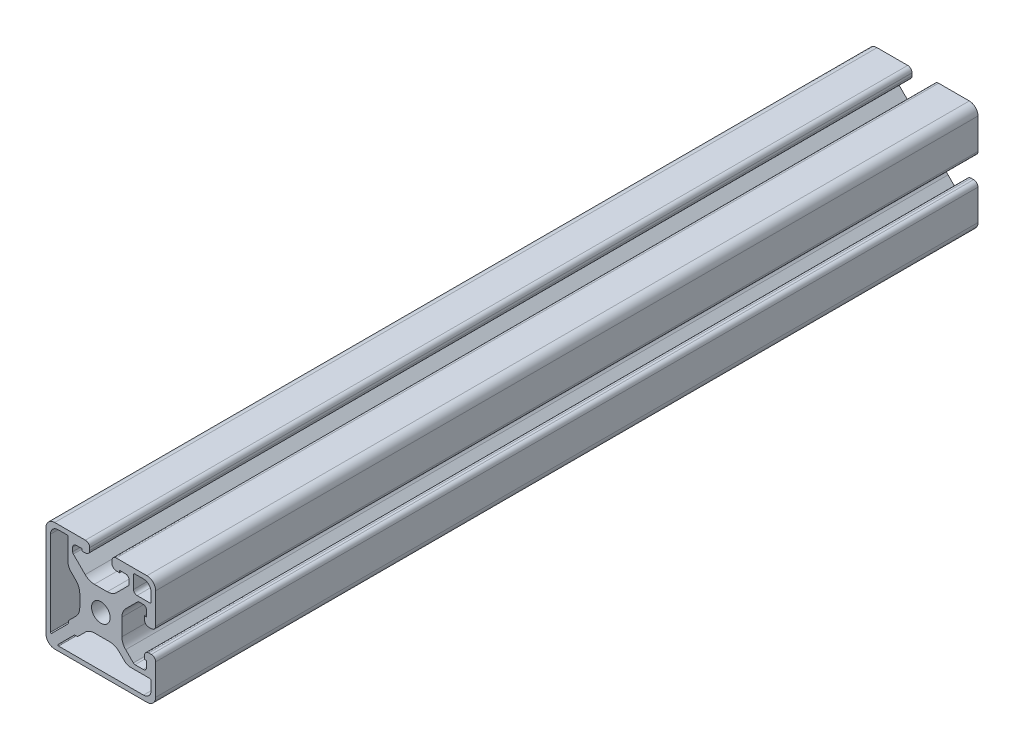
from build123d import *

# Parameters (mm, degrees)
SKETCH1_R      = 3.4
EXTRUDE1_DEPTH = 300


with BuildPart() as part:
    # Sketch1 → Extrude1 (new body)
    with BuildSketch(Plane.XY):
        with BuildLine():
            Line((2.355963526, 7.7), (-2.355963526, 7.7))
            ThreePointArc((-2.355963526, 7.7), (-4.173633293, 8.061556996), (-5.714579315, 9.091184211))
            Line((-5.714579315, 9.091184211), (-10.024617928, 13.401222824))
            ThreePointArc((-10.024617928, 13.401222824), (-10.217328904, 13.689635181), (-10.285, 14.029840753))
            Line((-10.285, 14.029840753), (-10.285, 15.432464473))
            ThreePointArc((-10.285, 15.432464473), (-9.913025612, 16.330490085), (-9.015, 16.702464473))
            Line((-9.015, 16.702464473), (-6.878524829, 16.702464473))
            Line((-6.878524829, 16.702464473), (-6.878524829, 15.94))
            Line((-6.878524829, 15.94), (-5.6348, 15.94))
            ThreePointArc((-5.6348, 15.94), (-4.521248241, 16.401248241), (-4.06, 17.5148))
            Line((-4.06, 17.5148), (-4.06, 18.4252))
            ThreePointArc((-4.06, 18.4252), (-4.521248241, 19.538751759), (-5.6348, 20))
            Line((-5.6348, 20), (-13.185697325, 20))
            Line((-13.185697325, 20), (-16.825, 20))
            ThreePointArc((-16.825, 20), (-19.07006403, 19.07006403), (-20, 16.825))
            Line((-20, 16.825), (-20, -16.825))
            ThreePointArc((-20, -16.825), (-19.07006403, -19.07006403), (-16.825, -20))
            Line((-16.825, -20), (0, -20))
            Line((0, -20), (16.825, -20))
            ThreePointArc((16.825, -20), (19.07006403, -19.07006403), (20, -16.825))
            Line((20, -16.825), (20, -13.049478217))
            Line((20, -13.049478217), (20, -5.6348))
            ThreePointArc((20, -5.6348), (19.538751759, -4.521248241), (18.4252, -4.06))
            Line((18.4252, -4.06), (17.5148, -4.06))
            ThreePointArc((17.5148, -4.06), (16.401248241, -4.521248241), (15.94, -5.6348))
            Line((15.94, -5.6348), (15.94, -6.878524829))
            Line((15.94, -6.878524829), (16.702464473, -6.878524829))
            Line((16.702464473, -6.878524829), (16.702464473, -9.015))
            ThreePointArc((16.702464473, -9.015), (16.330490085, -9.913025612), (15.432464473, -10.285))
            Line((15.432464473, -10.285), (12.495583974, -10.285))
            ThreePointArc((12.495583974, -10.285), (12.155378402, -10.217328904), (11.866966045, -10.024617928))
            Line((11.866966045, -10.024617928), (9.076184211, -7.233836094))
            ThreePointArc((9.076184211, -7.233836094), (8.046556996, -5.692890072), (7.685, -3.875220305))
            Line((7.685, -3.875220305), (7.685, 2.340963526))
            ThreePointArc((7.685, 2.340963526), (8.046556996, 4.158633293), (9.076184211, 5.699579315))
            Line((9.076184211, 5.699579315), (13.401222824, 10.024617928))
            ThreePointArc((13.401222824, 10.024617928), (13.689635181, 10.217328904), (14.029840753, 10.285))
            Line((14.029840753, 10.285), (15.432, 10.285))
            ThreePointArc((15.432, 10.285), (16.330025612, 9.913025612), (16.702, 9.015))
            Line((16.702, 9.015), (16.702, 6.878524829))
            Line((16.702, 6.878524829), (15.94, 6.878524829))
            Line((15.94, 6.878524829), (15.94, 5.6348))
            ThreePointArc((15.94, 5.6348), (16.401248241, 4.521248241), (17.5148, 4.06))
            Line((17.5148, 4.06), (18.4252, 4.06))
            ThreePointArc((18.4252, 4.06), (19.538751759, 4.521248241), (20, 5.6348))
            Line((20, 5.6348), (20, 12.980521783))
            Line((20, 12.980521783), (20, 16.825))
            ThreePointArc((20, 16.825), (19.07006403, 19.07006403), (16.825, 20))
            Line((16.825, 20), (13.070898915, 20))
            Line((13.070898915, 20), (5.6348, 20))
            ThreePointArc((5.6348, 20), (4.521248241, 19.538751759), (4.06, 18.4252))
            Line((4.06, 18.4252), (4.06, 17.5148))
            ThreePointArc((4.06, 17.5148), (4.521248241, 16.401248241), (5.6348, 15.94))
            Line((5.6348, 15.94), (6.878524829, 15.94))
            Line((6.878524829, 15.94), (6.878524829, 16.702464473))
            Line((6.878524829, 16.702464473), (9.015, 16.702464473))
            ThreePointArc((9.015, 16.702464473), (9.913025612, 16.330490085), (10.285, 15.432464473))
            Line((10.285, 15.432464473), (10.285, 14.029840753))
            ThreePointArc((10.285, 14.029840753), (10.217328904, 13.689635181), (10.024617928, 13.401222824))
            Line((10.024617928, 13.401222824), (5.714579315, 9.091184211))
            ThreePointArc((5.714579315, 9.091184211), (4.173633293, 8.061556996), (2.355963526, 7.7))
        make_face()
        Circle(SKETCH1_R, mode=Mode.SUBTRACT)
        with BuildLine():
            Line((-2.291485309, -7.67), (3.30475018, -7.67))
            ThreePointArc((3.30475018, -7.67), (5.122419947, -8.031556996), (6.663365969, -9.061184211))
            Line((6.663365969, -9.061184211), (8.607245789, -11.00506403))
            ThreePointArc((8.607245789, -11.00506403), (9.637289921, -11.693317516), (10.852309819, -11.935))
            Line((10.852309819, -11.935), (17.855103644, -11.935))
            ThreePointArc((17.855103644, -11.935), (18.205048213, -12.079951787), (18.35, -12.429896356))
            Line((18.35, -12.429896356), (18.35, -15.556))
            ThreePointArc((18.35, -15.556), (17.531656347, -17.531656347), (15.556, -18.35))
            Line((15.556, -18.35), (0, -18.35))
            Line((0, -18.35), (-15.414104785, -18.35))
            ThreePointArc((-15.414104785, -18.35), (-15.644649678, -18.195954828), (-15.590556207, -17.924008585))
            Line((-15.590556207, -17.924008585), (-9.805562467, -12.139014844))
            ThreePointArc((-9.805562467, -12.139014844), (-9.558352324, -11.973834194), (-9.266748072, -11.915830212))
            Line((-9.266748072, -11.915830212), (-8.820376291, -11.915829642))
            ThreePointArc((-8.820376291, -11.915829642), (-8.528772039, -11.857825659), (-8.281561897, -11.692645009))
            Line((-8.281561897, -11.692645009), (-5.650101098, -9.061184211))
            ThreePointArc((-5.650101098, -9.061184211), (-4.109155076, -8.031556996), (-2.291485309, -7.67))
        make_face(mode=Mode.SUBTRACT)
        with BuildLine():
            Line((-9.076184211, -5.741552749), (-11.62265199, -8.288020528))
            ThreePointArc((-11.62265199, -8.288020528), (-11.787832613, -8.535230605), (-11.845836623, -8.826834781))
            Line((-11.845836623, -8.826834781), (-11.845837163, -9.196755164))
            ThreePointArc((-11.845837163, -9.196755164), (-11.903841173, -9.488359341), (-12.069021796, -9.735569418))
            Line((-12.069021796, -9.735569418), (-17.924008585, -15.590556207))
            ThreePointArc((-17.924008585, -15.590556207), (-18.195954828, -15.644649678), (-18.35, -15.414104785))
            Line((-18.35, -15.414104785), (-18.35, 15.541))
            ThreePointArc((-18.35, 15.541), (-17.531656347, 17.516656347), (-15.556, 18.335))
            Line((-15.556, 18.335), (-12.316, 18.335))
            ThreePointArc((-12.316, 18.335), (-12.046592316, 18.223407684), (-11.935, 17.954))
            Line((-11.935, 17.954), (-11.935, 9.762593298))
            ThreePointArc((-11.935, 9.762593298), (-11.693317516, 8.5475734), (-11.00506403, 7.517529268))
            Line((-11.00506403, 7.517529268), (-9.076184211, 5.588649448))
            ThreePointArc((-9.076184211, 5.588649448), (-8.046556996, 4.047703426), (-7.685, 2.230033659))
            Line((-7.685, 2.230033659), (-7.685, -2.382936959))
            ThreePointArc((-7.685, -2.382936959), (-8.046556996, -4.200606726), (-9.076184211, -5.741552749))
        make_face(mode=Mode.SUBTRACT)
        with BuildLine():
            Line((18.35, 15.556), (18.35, 12.316))
            ThreePointArc((18.35, 12.316), (18.238407684, 12.046592316), (17.969, 11.935))
            Line((17.969, 11.935), (13.205, 11.935))
            ThreePointArc((13.205, 11.935), (12.306974388, 12.306974388), (11.935, 13.205))
            Line((11.935, 13.205), (11.935, 17.969))
            ThreePointArc((11.935, 17.969), (12.046592316, 18.238407684), (12.316, 18.35))
            Line((12.316, 18.35), (15.556, 18.35))
            ThreePointArc((15.556, 18.35), (17.531656347, 17.531656347), (18.35, 15.556))
        make_face(mode=Mode.SUBTRACT)
    extrude(amount=-EXTRUDE1_DEPTH)


solid = part.part
